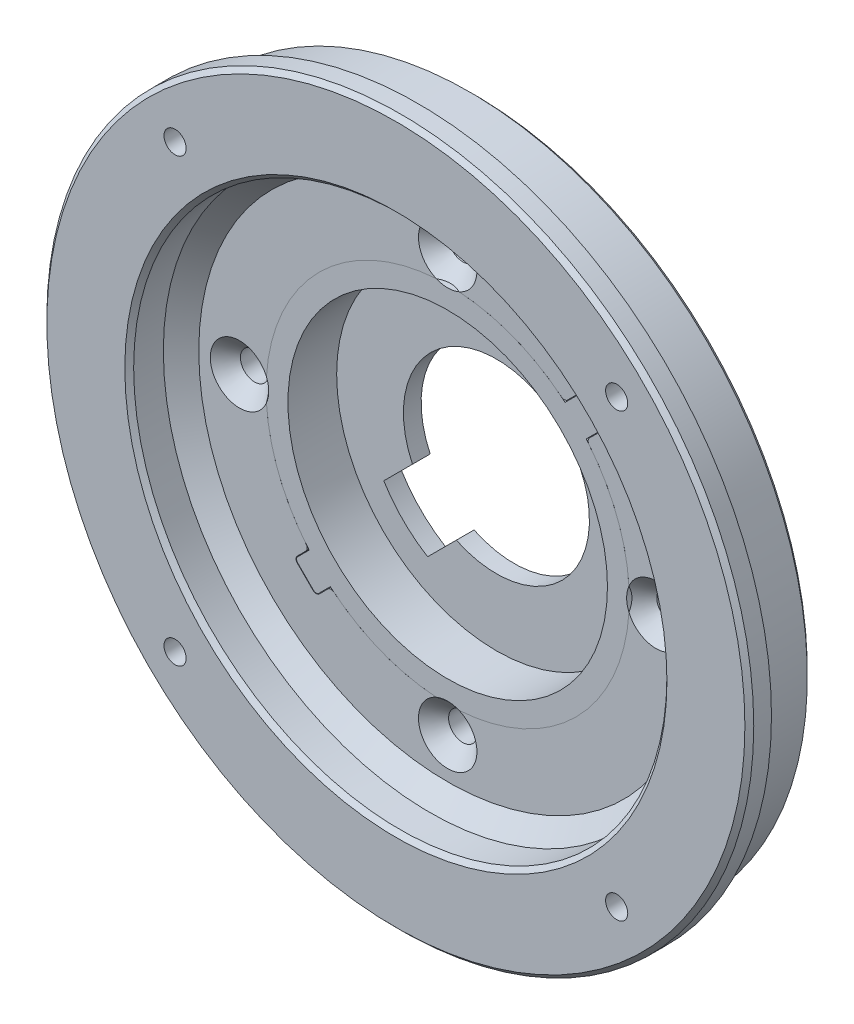
from build123d import *

# Parameters (mm, degrees)
SKETCH_1_R                = 38.1
SKETCH_1_R_2              = 30.1
EXTRUDE_1_DEPTH           = 3.35
SKETCH_2_R                = 39.9
SKETCH_2_R_2              = 30.1
EXTRUDE_2_DEPTH           = 2.5
EXTRUDE_START             = 3
SKETCH_4_R                = 38.1
SKETCH_4_R_2              = 20.5
EXTRUDE_3_DEPTH           = 3
CHAMFER_1_SIZE            = 2
SKETCH_5_R                = 1.5
CUT_EXTRUDE_1_DEPTH       = 10
CHAMFER_2_SIZE            = 0.5
SKETCH_6_R                = 29.5
SKETCH_6_R_2              = 20.5
SKETCH_6_R_3              = 1.5
EXTRUDE_4_DEPTH           = 5.5
CHAMFER_3_SIZE            = 3
CHAMFER_4_SIZE            = 0.5
HOLE_WIZARD_1_D           = 3.2
HOLE_WIZARD_1_DEPTH       = 12.5
HOLE_WIZARD_1_CSINK_D     = 6.6
HOLE_WIZARD_1_CSINK_ANGLE = 90
HOLE_WIZARD_1_TIP         = 0.96137699
SKETCH_8_R                = 1.2
CUT_EXTRUDE_2_DEPTH       = 10
HOLE_WIZARD_M3_1_D        = 2.5
HOLE_WIZARD_M3_1_DEPTH    = 12.5
HOLE_WIZARD_M3_1_TIP      = 0.751075774
CUT_EXTRUDE_4_DEPTH       = 4.5
FILLET_3_R                = 0.5
SKETCH_13_R               = 18.035
EXTRUDE_5_DEPTH           = 4.5
SKETCH_14_R               = 20.4
SKETCH_14_R_2             = 18.035
EXTRUDE_6_DEPTH           = 2
SKETCH_15_R               = 20.4
SKETCH_15_R_2             = 18.035
EXTRUDE_7_DEPTH           = 1
SKETCH_16_R               = 18.035
SKETCH_16_R_2             = 10.5
EXTRUDE_8_DEPTH           = 2
SKETCH_17_R               = 3.3
CUT_EXTRUDE_5_DEPTH       = 14
SKETCH_18_R               = 1.5
CUT_EXTRUDE_6_DEPTH       = 40
CUT_EXTRUDE_7_DEPTH       = 80


with BuildPart() as part:
    # 草图1 → 凸台-拉伸1 (new body)
    with BuildSketch(Plane.XY):
        Circle(SKETCH_1_R)
        Circle(SKETCH_1_R_2, mode=Mode.SUBTRACT)
    extrude(amount=EXTRUDE_1_DEPTH)

    # 草图2 → 凸台-拉伸2 (add)
    with BuildSketch(Plane.XY.offset(3.35)):
        Circle(SKETCH_2_R)
        Circle(SKETCH_2_R_2, mode=Mode.SUBTRACT)
    extrude(amount=EXTRUDE_2_DEPTH)

    # 草图4 → 凸台-拉伸3 (add)
    with BuildSketch(Plane(origin=(0, 0, 0), x_dir=(-1, 0, 0), z_dir=(0, 0, -1)).offset(EXTRUDE_START)):
        Circle(SKETCH_4_R)
        Circle(SKETCH_4_R_2, mode=Mode.SUBTRACT)
    extrude(amount=-EXTRUDE_3_DEPTH)

    # 倒角1
    chamfer_1_edges = [part.edges().sort_by_distance(p)[0] for p in [
        (-30.1, 0, 0),
    ]]
    chamfer(chamfer_1_edges, length=CHAMFER_1_SIZE)

    # 草图5 → 切除-拉伸1 (cut)
    with BuildSketch(Plane.XY):
        with Locations((-23.5, 0)):
            Circle(SKETCH_5_R)
        with Locations((0, 23.5)):
            Circle(SKETCH_5_R)
        with Locations((23.5, 0)):
            Circle(SKETCH_5_R)
        with Locations((0, -23.5)):
            Circle(SKETCH_5_R)
    extrude(amount=-CUT_EXTRUDE_1_DEPTH, mode=Mode.SUBTRACT)

    # 倒角2
    chamfer_2_edges = [part.edges().sort_by_distance(p)[0] for p in [
        (-39.9, 0, 5.85),
        (-30.1, 0, 5.85),
    ]]
    chamfer(chamfer_2_edges, length=CHAMFER_2_SIZE)

    # 草图6 → 凸台-拉伸4 (add)
    with BuildSketch(Plane(origin=(0, 0, -3), x_dir=(-1, 0, 0), z_dir=(0, 0, -1))):
        Circle(SKETCH_6_R)
        Circle(SKETCH_6_R_2, mode=Mode.SUBTRACT)
        with Locations(Location((23.5, 0, 0), (0, 0, 180))):
            Circle(SKETCH_6_R_3, mode=Mode.SUBTRACT)
        with Locations(Location((0, 23.5, 0), (0, 0, 180))):
            Circle(SKETCH_6_R_3, mode=Mode.SUBTRACT)
        with Locations(Location((-23.5, 0, 0), (0, 0, 180))):
            Circle(SKETCH_6_R_3, mode=Mode.SUBTRACT)
        with Locations(Location((0, -23.5, 0), (0, 0, 180))):
            Circle(SKETCH_6_R_3, mode=Mode.SUBTRACT)
    extrude(amount=EXTRUDE_4_DEPTH)

    # 倒角3
    chamfer_3_edges = [part.edges().sort_by_distance(p)[0] for p in [
        (29.5, 0, -3),
    ]]
    chamfer(chamfer_3_edges, length=CHAMFER_3_SIZE)

    # 倒角4
    chamfer_4_edges = [part.edges().sort_by_distance(p)[0] for p in [
        (38.1, 0, -3),
    ]]
    chamfer(chamfer_4_edges, length=CHAMFER_4_SIZE)

    # 打孔尺寸(%根据十字)槽半沉头木螺钉的类型1
    with Locations(Plane(origin=(23.5, 0, 0), x_dir=(1, 0, 0), z_dir=(0, 0, 1))):
        with Locations((0, 0), (-23.5, -23.5), (-47, 0), (-23.5, 23.5)):
            CounterSinkHole(HOLE_WIZARD_1_D / 2, HOLE_WIZARD_1_CSINK_D / 2, depth=HOLE_WIZARD_1_DEPTH, counter_sink_angle=HOLE_WIZARD_1_CSINK_ANGLE)
            with Locations((0, 0, -(HOLE_WIZARD_1_DEPTH + HOLE_WIZARD_1_TIP / 2))):  # 118° drill point
                Cone(0, HOLE_WIZARD_1_D / 2, HOLE_WIZARD_1_TIP, mode=Mode.SUBTRACT)

    # 草图8 → 切除-拉伸2 (cut)
    with BuildSketch(Plane(origin=(0, 0, -3), x_dir=(-1, 0, 0), z_dir=(0, 0, -1))):
        with Locations((-24.925514037, -24.925514037)):
            Circle(SKETCH_8_R)
        with Locations((-24.925514037, 24.925514037)):
            Circle(SKETCH_8_R)
        with Locations((24.925514037, 24.925514037)):
            Circle(SKETCH_8_R)
        with Locations((24.925514037, -24.925514037)):
            Circle(SKETCH_8_R)
    extrude(amount=-CUT_EXTRUDE_2_DEPTH, mode=Mode.SUBTRACT)

    # M3 螺纹孔1
    with Locations(Plane(origin=(24.925514037, 24.925514037, 5.85), x_dir=(1, 0, 0), z_dir=(0, 0, 1))):
        with Locations((0, 0), (0, -49.851028074), (-49.851028074, -49.851028074), (-49.851028074, 0)):
            Hole(HOLE_WIZARD_M3_1_D / 2, depth=HOLE_WIZARD_M3_1_DEPTH)
            with Locations((0, 0, -(HOLE_WIZARD_M3_1_DEPTH + HOLE_WIZARD_M3_1_TIP / 2))):  # 118° drill point
                Cone(0, HOLE_WIZARD_M3_1_D / 2, HOLE_WIZARD_M3_1_TIP, mode=Mode.SUBTRACT)

    # 草图12 → 切除-拉伸4 (cut)
    with BuildSketch(Plane.XY):
        with BuildLine():
            Line((15.680211877, 13.205338143), (17.324116139, 14.849242405))
            Line((17.324116139, 14.849242405), (14.849242405, 17.324116139))
            Line((14.849242405, 17.324116139), (13.205338143, 15.680211877))
            ThreePointArc((13.205338143, 15.680211877), (14.495689014, 14.495689014), (15.680211877, 13.205338143))
        make_face()
        with BuildLine():
            Line((-14.849242405, -17.324116139), (-13.205338143, -15.680211877))
            ThreePointArc((-13.205338143, -15.680211877), (-14.495689014, -14.495689014), (-15.680211877, -13.205338143))
            Line((-15.680211877, -13.205338143), (-17.324116139, -14.849242405))
            Line((-17.324116139, -14.849242405), (-14.849242405, -17.324116139))
        make_face()
        with BuildLine():
            ThreePointArc((-15.680211877, -13.205338143), (-14.495689014, -14.495689014), (-13.205338143, -15.680211877))
            Line((-13.205338143, -15.680211877), (-11.66726189, -14.142135624))
            ThreePointArc((-11.66726189, -14.142135624), (-11.66726189, -11.66726189), (-14.142135624, -11.66726189))
            Line((-14.142135624, -11.66726189), (-15.680211877, -13.205338143))
        make_face()
        with BuildLine():
            Line((14.142135624, 11.66726189), (15.680211877, 13.205338143))
            ThreePointArc((15.680211877, 13.205338143), (14.495689014, 14.495689014), (13.205338143, 15.680211877))
            Line((13.205338143, 15.680211877), (11.66726189, 14.142135624))
            ThreePointArc((11.66726189, 14.142135624), (11.66726189, 11.66726189), (14.142135624, 11.66726189))
        make_face()
    extrude(amount=-CUT_EXTRUDE_4_DEPTH, mode=Mode.SUBTRACT)

    # 圆角3
    fillet_3_edges = [part.edges().sort_by_distance(p)[0] for p in [
        (13.205338143, 15.680211877, -2.25),
        (15.680211877, 13.205338143, -2.25),
        (-13.205338143, -15.680211877, -2.25),
        (-15.680211877, -13.205338143, -2.25),
        (-17.324116139, -14.849242405, -2.25),
        (-14.849242405, -17.324116139, -2.25),
        (14.849242405, 17.324116139, -2.25),
        (17.324116139, 14.849242405, -2.25),
    ]]
    fillet(fillet_3_edges, radius=FILLET_3_R)


with BuildPart() as body_2:
    # 草图13 → 凸台-拉伸5 (new body)
    with BuildSketch(Plane.XY):
        with BuildLine():
            Line((-13.255164389, -15.638114241), (-14.541650955, -16.924600808))
            ThreePointArc((-14.541650955, -16.924600808), (-14.849242405, -17.052009358), (-15.156833855, -16.924600808))
            Line((-15.156833855, -16.924600808), (-16.924600808, -15.156833855))
            ThreePointArc((-16.924600808, -15.156833855), (-17.052009358, -14.849242405), (-16.924600808, -14.541650955))
            Line((-16.924600808, -14.541650955), (-15.638114241, -13.255164389))
            ThreePointArc((-15.638114241, -13.255164389), (-14.495689014, 14.495689014), (13.255164389, 15.638114241))
            Line((13.255164389, 15.638114241), (14.541650955, 16.924600808))
            ThreePointArc((14.541650955, 16.924600808), (14.849242405, 17.052009358), (15.156833855, 16.924600808))
            Line((15.156833855, 16.924600808), (16.924600808, 15.156833855))
            ThreePointArc((16.924600808, 15.156833855), (17.052009358, 14.849242405), (16.924600808, 14.541650955))
            Line((16.924600808, 14.541650955), (15.638114241, 13.255164389))
            ThreePointArc((15.638114241, 13.255164389), (14.495689014, -14.495689014), (-13.255164389, -15.638114241))
        make_face()
        Circle(SKETCH_13_R, mode=Mode.SUBTRACT)
    extrude(amount=-EXTRUDE_5_DEPTH)

    # 草图14 → 凸台-拉伸6 (add)
    with BuildSketch(Plane(origin=(0, 0, -4.5), x_dir=(-1, 0, 0), z_dir=(0, 0, -1))):
        Circle(SKETCH_14_R)
        with Locations(Location((0, 0, 0), (0, 0, 180))):
            Circle(SKETCH_14_R_2, mode=Mode.SUBTRACT)
    extrude(amount=EXTRUDE_6_DEPTH)

    # 草图15 → 凸台-拉伸7 (add)
    with BuildSketch(Plane(origin=(0, 0, -6.5), x_dir=(-1, 0, 0), z_dir=(0, 0, -1))):
        Circle(SKETCH_15_R)
        with Locations(Location((0, 0, 0), (0, 0, 180))):
            Circle(SKETCH_15_R_2, mode=Mode.SUBTRACT)
    extrude(amount=EXTRUDE_7_DEPTH)

    # 草图16 → 凸台-拉伸8 (add)
    with BuildSketch(Plane(origin=(0, 0, -7.5), x_dir=(-1, 0, 0), z_dir=(0, 0, -1))):
        with Locations(Location((0, 0, 0), (0, 0, 180))):
            Circle(SKETCH_16_R)
        Circle(SKETCH_16_R_2, mode=Mode.SUBTRACT)
    extrude(amount=-EXTRUDE_8_DEPTH)

    # 草图17 → 切除-拉伸5 (cut)
    with BuildSketch(Plane.XY):
        with Locations((-23.5, 0)):
            Circle(SKETCH_17_R)
        with Locations((0, -23.5)):
            Circle(SKETCH_17_R)
        with Locations((0, 23.5)):
            Circle(SKETCH_17_R)
        with Locations((23.5, 0)):
            Circle(SKETCH_17_R)
    extrude(amount=-CUT_EXTRUDE_5_DEPTH, mode=Mode.SUBTRACT)

    # 草图18 → 切除-拉伸6 (cut, symmetric)
    with BuildSketch(Plane(origin=(0, 0, 0), x_dir=(0, 0, -1), z_dir=(0.707106781186549, -0.707106781186546, 0))):
        with Locations(Location((2.94, 0, 0), (0, 0, 90))):
            Circle(SKETCH_18_R)
    extrude(amount=CUT_EXTRUDE_6_DEPTH, both=True, mode=Mode.SUBTRACT)

    # 草图19 → 切除-拉伸7 (cut)
    with BuildSketch(Plane.XY.offset(-5.5)):
        with BuildLine():
            Line((-7.766219957, -12.715967426), (12.715967426, 7.766219957))
            ThreePointArc((12.715967426, 7.766219957), (10.53589104, 10.53589104), (7.766219957, 12.715967426))
            Line((7.766219957, 12.715967426), (-12.715967426, -7.766219957))
            ThreePointArc((-12.715967426, -7.766219957), (-10.53589104, -10.53589104), (-7.766219957, -12.715967426))
        make_face()
    extrude(amount=-CUT_EXTRUDE_7_DEPTH, mode=Mode.SUBTRACT)


solid = Compound([part.part, body_2.part])
